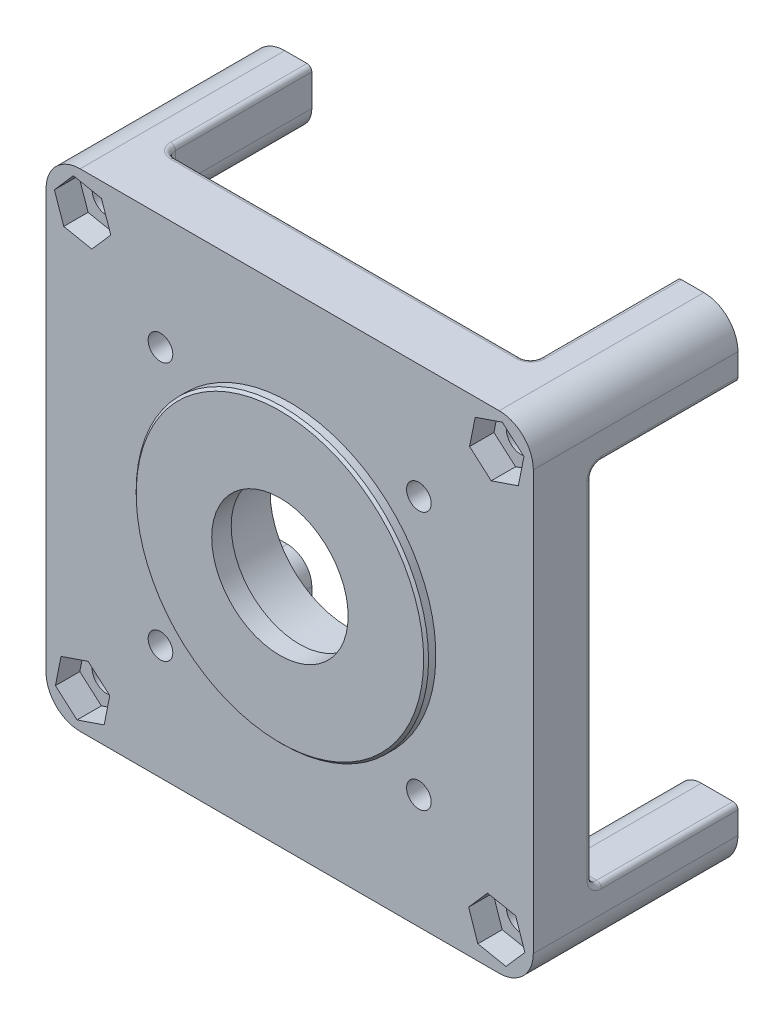
from build123d import *

# Parameters (mm, degrees)
SKETCH2_W                  = 100
SKETCH2_H                  = 100
BOSS_EXTRUDE1_DEPTH        = 12
SKETCH3_R                  = 16
CUT_EXTRUDE1_DEPTH         = 10
M6_CLEARANCE_HOLE1_D       = 6.1
BOSS_EXTRUDE2_START        = 30
SKETCH17_R                 = 3.05
BOSS_EXTRUDE2_DEPTH        = 30
CIRPATTERN1_COUNT          = 4
SKETCH18_R                 = 14
CUT_EXTRUDE3_DEPTH         = 77.811457479
FILLET1_R                  = 2
FILLET2_R                  = 7
CUT_EXTRUDE6_DEPTH         = 5
CIRPATTERN2_COUNT          = 4
SKETCH25_R                 = 30
SKETCH25_R_2               = 14
BOSS_EXTRUDE3_DEPTH        = 2
F_8_0_199_DIAMETER_HOLE1_D = 5.0546
CHAMFER1_SIZE              = 0.5
FILLET3_R                  = 1


with BuildPart() as part:
    # Sketch2 → Boss-Extrude1 (new body)
    with BuildSketch(Plane.XY):
        Rectangle(SKETCH2_W, SKETCH2_H)
    extrude(amount=BOSS_EXTRUDE1_DEPTH)

    # Sketch3 → Cut-Extrude1 (cut)
    with BuildSketch(Plane(origin=(0, 0, 0), x_dir=(-1, 0, 0), z_dir=(0, 0, -1))):
        Circle(SKETCH3_R)
    extrude(amount=-CUT_EXTRUDE1_DEPTH, mode=Mode.SUBTRACT)

    # M6 Clearance Hole1 (through all)
    with Locations(Plane(origin=(0, 0, 12), x_dir=(-1, 0, 0), z_dir=(0, 0, 1))):
        with Locations((42.5, -42.5), (-42.5, 42.5), (-42.5, -42.5), (42.5, 42.5)):
            Hole(M6_CLEARANCE_HOLE1_D / 2)

    # Sketch17 → Boss-Extrude2 (add)
    with BuildSketch(Plane(origin=(0, 0, 0), x_dir=(-1, 0, 0), z_dir=(0, 0, -1)).offset(BOSS_EXTRUDE2_START)):
        with BuildLine():
            Line((-37.45, 42.5), (-37.45, 50))
            Line((-37.45, 50), (-50, 50))
            Line((-50, 50), (-50, 37.45))
            Line((-50, 37.45), (-42.5, 37.45))
            ThreePointArc((-42.5, 37.45), (-38.929110755, 38.929110755), (-37.45, 42.5))
        make_face()
        with Locations(Location((-42.5, 42.5, 0), (0, 0, 180))):
            Circle(SKETCH17_R, mode=Mode.SUBTRACT)
    boss_extrude2 = extrude(amount=-BOSS_EXTRUDE2_DEPTH)

    # CirPattern1: Boss-Extrude2 ×4 about axis
    cirpattern1_axis = Axis((0, 0, 0), (0, 0, 1))
    for i in range(1, CIRPATTERN1_COUNT):
        add(boss_extrude2.rotate(cirpattern1_axis, i * 360 / CIRPATTERN1_COUNT))

    # Sketch18 → Cut-Extrude3 (cut, through all)
    with BuildSketch(Plane(origin=(0, 0, 0), x_dir=(-1, 0, 0), z_dir=(0, 0, -1))):
        Circle(SKETCH18_R)
    extrude(amount=-CUT_EXTRUDE3_DEPTH, mode=Mode.SUBTRACT)

    # Fillet1
    fillet1_edges = [part.edges().sort_by_distance(p)[0] for p in [
        (38.929110755, 38.929110755, 0),
        (37.45, 46.25, 0),
        (46.25, 37.45, 0),
        (-38.929110755, 38.929110755, 0),
        (-46.25, 37.45, 0),
        (-37.45, 46.25, 0),
        (-38.929110755, -38.929110755, 0),
        (-37.45, -46.25, 0),
        (-46.25, -37.45, 0),
        (38.929110755, -38.929110755, 0),
        (46.25, -37.45, 0),
        (37.45, -46.25, 0),
    ]]
    fillet(fillet1_edges, radius=FILLET1_R)

    # Fillet2
    fillet2_edges = [part.edges().sort_by_distance(p)[0] for p in [
        (50, -50, -9),
        (-50, -50, -9),
        (-50, 50, -9),
        (50, 50, -9),
    ]]
    fillet(fillet2_edges, radius=FILLET2_R)

    # Sketch24 → Cut-Extrude6 (cut)
    with BuildSketch(Plane.XY.offset(12)):
        Polygon((-44.400625379, 48.073833795), (-48.277394352, 43.640927036), (-46.376768973, 38.067093242), (-40.599374621, 36.926166205), (-36.722605648, 41.359072964), (-38.623231027, 46.932906758), align=None)
    cut_extrude6 = extrude(amount=-CUT_EXTRUDE6_DEPTH, mode=Mode.SUBTRACT)

    # CirPattern2: Cut-Extrude6 ×4 about axis
    cirpattern2_axis = Axis((0, 0, 0), (0, 0, 1))
    for i in range(1, CIRPATTERN2_COUNT):
        add(cut_extrude6.rotate(cirpattern2_axis, i * 360 / CIRPATTERN2_COUNT), mode=Mode.SUBTRACT)

    # Sketch25 → Boss-Extrude3 (add)
    with BuildSketch(Plane.XY.offset(12)):
        with Locations(Location((0, 0, 0), (0, 0, 180))):
            Circle(SKETCH25_R)
        with Locations(Location((0, 0, 0), (0, 0, 180))):
            Circle(SKETCH25_R_2, mode=Mode.SUBTRACT)
    extrude(amount=BOSS_EXTRUDE3_DEPTH)

    # #8 (0.199) Diameter Hole1 (through all)
    with Locations(Plane(origin=(26.516504294, 26.516504294, 12), x_dir=(1, 0, 0), z_dir=(0, 0, 1))):
        with Locations((0, 0), (-53.033008588, 0), (-53.033008588, -53.033008588), (0, -53.033008588)):
            Hole(F_8_0_199_DIAMETER_HOLE1_D / 2)

    # Chamfer1
    chamfer1_edges = [part.edges().sort_by_distance(p)[0] for p in [
        (30, 0, 14),
    ]]
    chamfer(chamfer1_edges, length=CHAMFER1_SIZE)

    # Fillet3
    fillet3_edges = [part.edges().sort_by_distance(p)[0] for p in [
        (50, 0, 0),
        (0, -50, 0),
        (-50, 0, 0),
        (0, 50, 0),
        (-36.864213562, 50, -0.585786438),
        (-50, 36.864213562, -0.585786438),
        (-50, -36.864213562, -0.585786438),
        (-36.864213562, -50, -0.585786438),
        (36.864213562, -50, -0.585786438),
        (50, -36.864213562, -0.585786438),
        (50, 36.864213562, -0.585786438),
        (36.864213562, 50, -0.585786438),
        (37.45, 50, -16),
        (50, 37.45, -16),
        (-50, 37.45, -16),
        (-37.45, 50, -16),
        (-37.45, -50, -16),
        (-50, -37.45, -16),
        (50, -37.45, -16),
        (37.45, -50, -16),
    ]]
    fillet(fillet3_edges, radius=FILLET3_R)


solid = part.part
